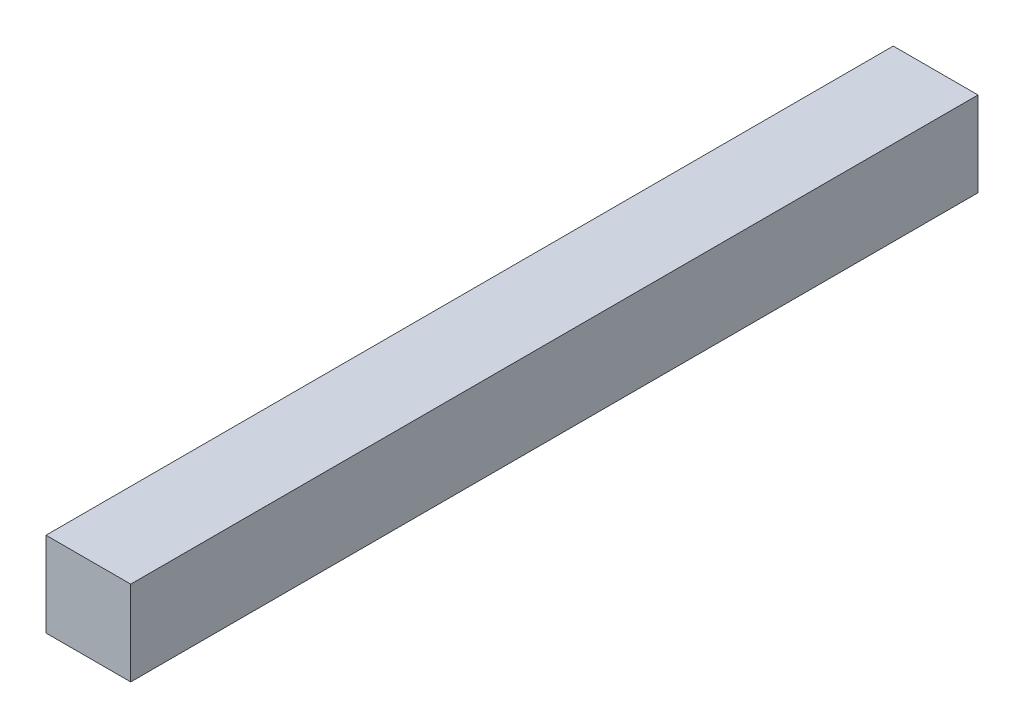
from build123d import *

# Parameters (mm, degrees)
SKETCH_1_W      = 20
SKETCH_1_H      = 20
EXTRUDE_1_DEPTH = 200


with BuildPart() as part:
    # 草图1 → 凸台-拉伸1 (new body)
    with BuildSketch(Plane.XY):
        with Locations((10, 10)):
            Rectangle(SKETCH_1_W, SKETCH_1_H)
    extrude(amount=EXTRUDE_1_DEPTH)


solid = part.part
